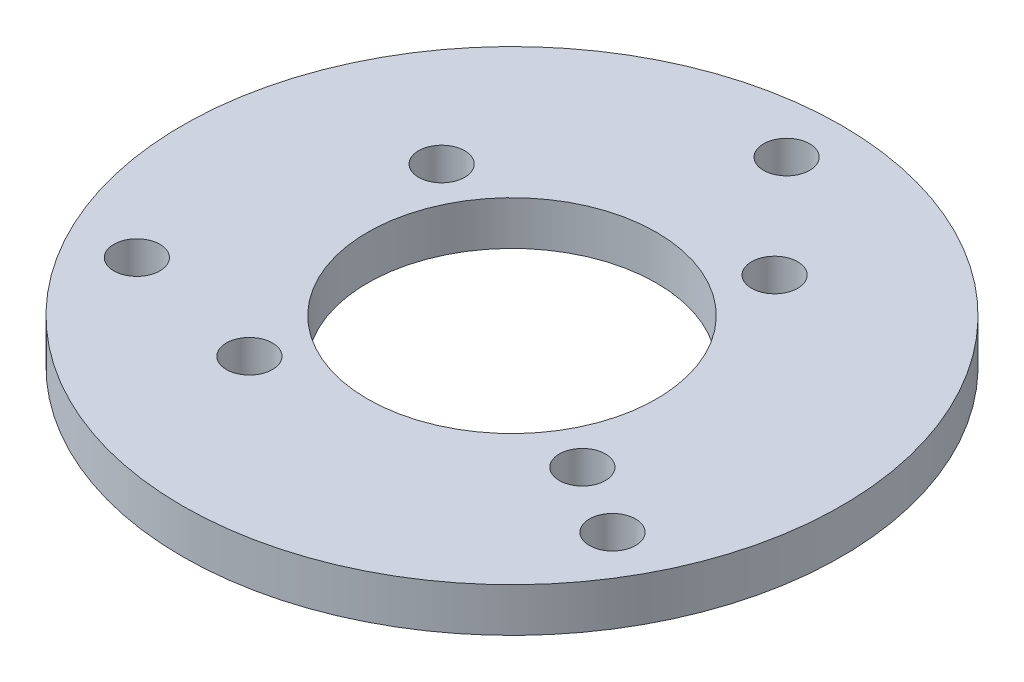
from build123d import *

# Parameters (mm, degrees)
SKETCH_1_R               = 30
EXTRUDE_1_DEPTH          = 4
SKETCH_2_R               = 2.1
CUT_EXTRUDE_1_DEPTH      = 4
PATTERN_CIRCULAR_1_COUNT = 3
SKETCH_3_R               = 13.15
CUT_EXTRUDE_2_DEPTH      = 17
SKETCH_4_R               = 2.1
CUT_EXTRUDE_3_DEPTH      = 17
PATTERN_CIRCULAR_2_COUNT = 4


with BuildPart() as part:
    # 草图1 → 凸台-拉伸1 (new body)
    with BuildSketch(Plane(origin=(0, 0, 0), x_dir=(1, 0, 0), z_dir=(0, 1, 0))):
        with Locations(Location((0, 0, 0), (0, 0, 270))):
            Circle(SKETCH_1_R)
    extrude(amount=EXTRUDE_1_DEPTH)

    # 草图2 → 切除-拉伸1 (cut)
    with BuildSketch(Plane(origin=(0, 4, 0), x_dir=(1, 0, 0), z_dir=(0, 1, 0))):
        with Locations(Location((0, 25, 0), (0, 0, 270))):
            Circle(SKETCH_2_R)
    cut_extrude_1 = extrude(amount=-CUT_EXTRUDE_1_DEPTH, mode=Mode.SUBTRACT)

    # 阵列(圆周)1: 切除-拉伸1 ×3 about axis
    pattern_circular_1_axis = Axis((0, 0, 0), (0, 1, 0))
    for i in range(1, PATTERN_CIRCULAR_1_COUNT):
        add(cut_extrude_1.rotate(pattern_circular_1_axis, i * 360 / PATTERN_CIRCULAR_1_COUNT), mode=Mode.SUBTRACT)

    # 草图3 → 切除-拉伸2 (cut)
    with BuildSketch(Plane(origin=(0, 4, 0), x_dir=(1, 0, 0), z_dir=(0, 1, 0))):
        with Locations(Location((0, 0, 0), (0, 0, 270))):
            Circle(SKETCH_3_R)
    extrude(amount=-CUT_EXTRUDE_2_DEPTH, mode=Mode.SUBTRACT)

    # 草图4 → 切除-拉伸3 (cut)
    with BuildSketch(Plane(origin=(0, 4, 0), x_dir=(1, 0, 0), z_dir=(0, 1, 0))):
        with Locations(Location((15.155444566, -8.75, 0), (0, 0, 270))):
            Circle(SKETCH_4_R)
    cut_extrude_3 = extrude(amount=-CUT_EXTRUDE_3_DEPTH, mode=Mode.SUBTRACT)

    # 阵列(圆周)2: 切除-拉伸3 ×4 about axis
    pattern_circular_2_axis = Axis((0, 0, 0), (0, 1, 0))
    for i in range(1, PATTERN_CIRCULAR_2_COUNT):
        add(cut_extrude_3.rotate(pattern_circular_2_axis, i * 360 / PATTERN_CIRCULAR_2_COUNT), mode=Mode.SUBTRACT)


solid = part.part
